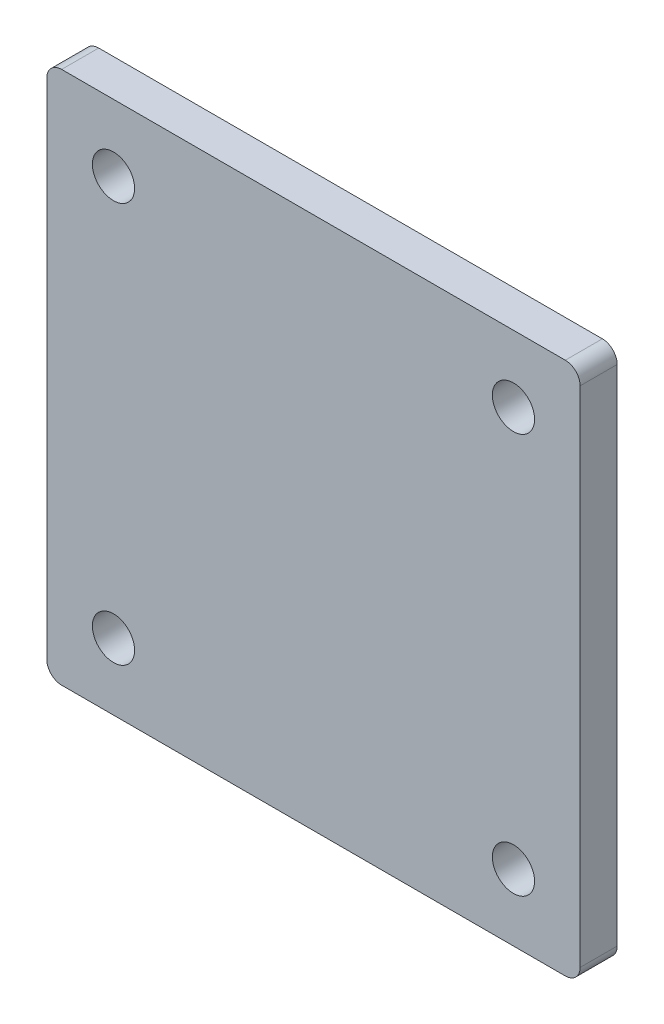
from build123d import *

# Parameters (mm, degrees)
SKETCH1_W           = 72
SKETCH1_H           = 72
SKETCH1_R           = 2.85
BOSS_EXTRUDE1_DEPTH = 5
FILLET1_R           = 2
FILLET2_R           = 2


with BuildPart() as part:
    # Sketch1 → Boss-Extrude1 (new body)
    with BuildSketch(Plane.XY):
        Rectangle(SKETCH1_W, SKETCH1_H)
        with Locations((-27, 27)):
            Circle(SKETCH1_R, mode=Mode.SUBTRACT)
        with Locations((27, 27)):
            Circle(SKETCH1_R, mode=Mode.SUBTRACT)
        with Locations((27, -27)):
            Circle(SKETCH1_R, mode=Mode.SUBTRACT)
        with Locations((-27, -27)):
            Circle(SKETCH1_R, mode=Mode.SUBTRACT)
    extrude(amount=BOSS_EXTRUDE1_DEPTH)

    # Fillet1
    fillet1_edges = [part.edges().sort_by_distance(p)[0] for p in [
        (-36, 36, 2.5),
    ]]
    fillet(fillet1_edges, radius=FILLET1_R)

    # Fillet2
    fillet2_edges = [part.edges().sort_by_distance(p)[0] for p in [
        (36, 36, 2.5),
        (36, -36, 2.5),
        (-36, -36, 2.5),
    ]]
    fillet(fillet2_edges, radius=FILLET2_R)


solid = part.part
